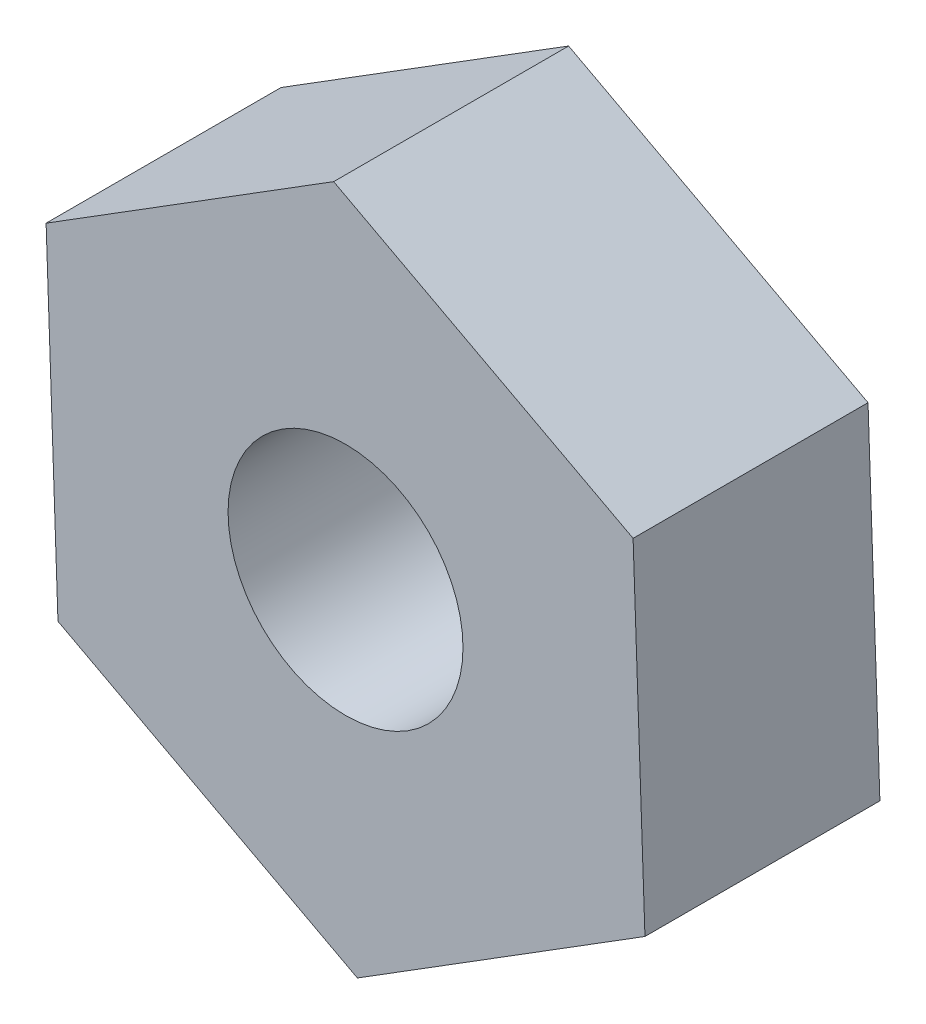
from build123d import *

# Parameters (mm, degrees)
SKETCH_1_R      = 1
EXTRUDE_1_DEPTH = 2


with BuildPart() as part:
    # ｽｹｯﾁ1 → ﾎﾞｽ - 押し出し1 (new body)
    with BuildSketch(Plane.XY):
        Polygon((2.447954647, 1.529984112), (-0.101027785, 2.884982967), (-2.548982431, 1.354998855), (-2.447954647, -1.529984112), (0.101027785, -2.884982967), (2.548982431, -1.354998855), align=None)
        Circle(SKETCH_1_R, mode=Mode.SUBTRACT)
    extrude(amount=EXTRUDE_1_DEPTH)


solid = part.part
